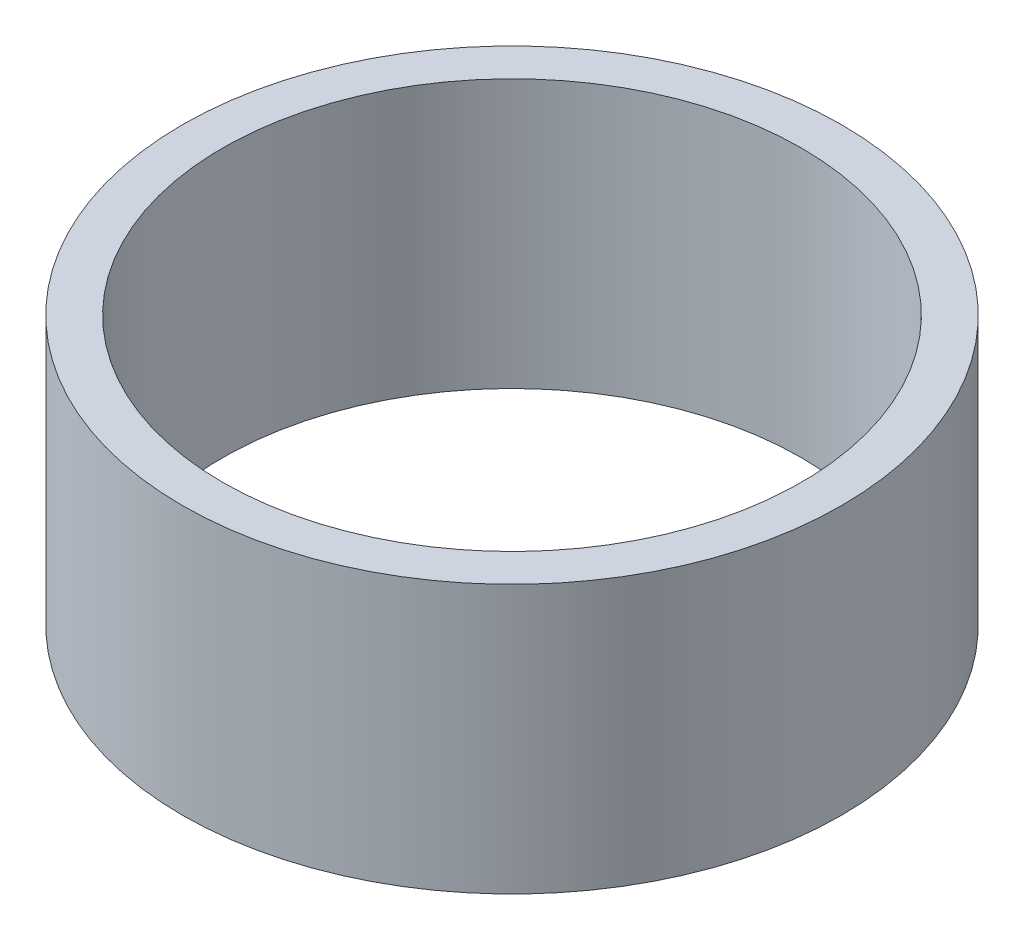
from build123d import *

# Parameters (mm, degrees)
SKETCH2_R           = 24.584776311
SKETCH2_R_2         = 21.584776311
BOSS_EXTRUDE1_DEPTH = 10


with BuildPart() as part:
    # Sketch2 → Boss-Extrude1 (new, symmetric)
    with BuildSketch(Plane(origin=(0, 0, 0), x_dir=(1, 0, 0), z_dir=(0, 1, 0))):
        with Locations(Location((0, 0, 0), (0, 0, 270))):
            Circle(SKETCH2_R)
        with Locations(Location((0, 0, 0), (0, 0, 270))):
            Circle(SKETCH2_R_2, mode=Mode.SUBTRACT)
    extrude(amount=BOSS_EXTRUDE1_DEPTH, both=True)


solid = part.part
